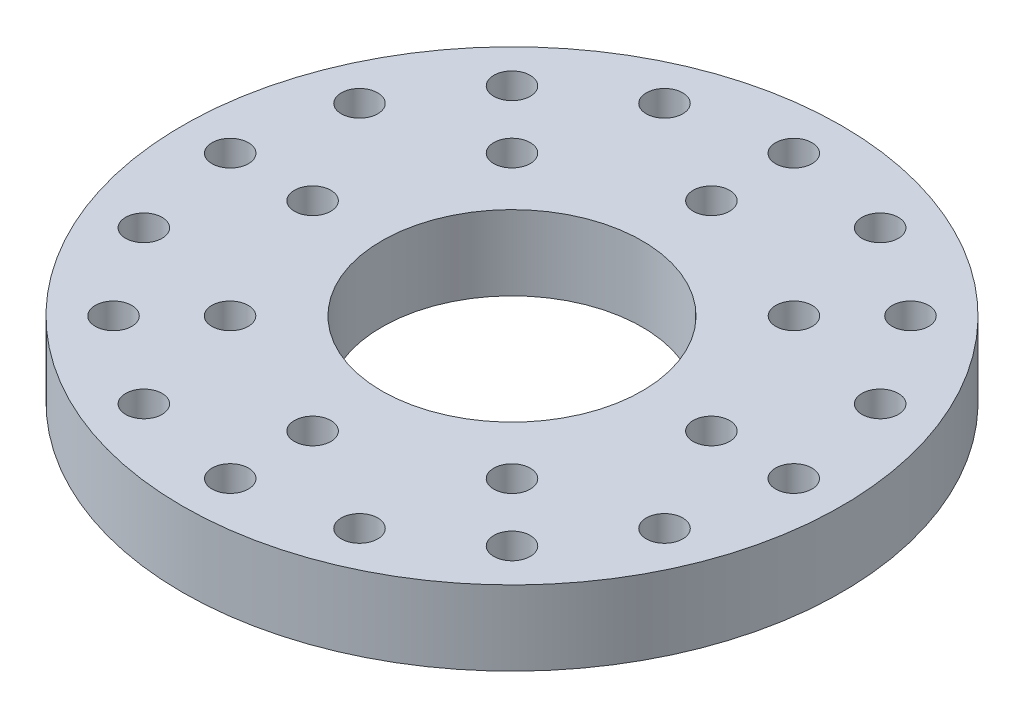
from build123d import *

# Parameters (mm, degrees)
SKETCH1_R          = 76.2
EXTRUDE1_DEPTH     = 17.272
SKETCH2_R          = 30.099
CUT_EXTRUDE1_DEPTH = 22.352
SKETCH3_R          = 4.2164
CUT_EXTRUDE3_DEPTH = 22.352
CIRPATTERN1_COUNT  = 8
SKETCH4_R          = 4.2164
CUT_EXTRUDE4_DEPTH = 22.352
CIRPATTERN2_COUNT  = 16


with BuildPart() as part:
    # Sketch1 → Extrude1 (new body)
    with BuildSketch(Plane(origin=(0, 0, 0), x_dir=(1, 0, 0), z_dir=(0, 1, 0))):
        Circle(SKETCH1_R)
    extrude(amount=EXTRUDE1_DEPTH)

    # Sketch2 → Cut-Extrude1 (cut)
    with BuildSketch(Plane(origin=(0, 0, 0), x_dir=(1, 0, 0), z_dir=(0, 1, 0))):
        Circle(SKETCH2_R)
    extrude(amount=CUT_EXTRUDE1_DEPTH, mode=Mode.SUBTRACT)

    # Sketch3 → Cut-Extrude3 (cut)
    with BuildSketch(Plane(origin=(0, 0, 0), x_dir=(1, 0, 0), z_dir=(0, 1, 0))):
        with Locations((0, 46.101)):
            Circle(SKETCH3_R)
    cut_extrude3 = extrude(amount=CUT_EXTRUDE3_DEPTH, mode=Mode.SUBTRACT)

    # CirPattern1: Cut-Extrude3 ×8 about axis
    cirpattern1_axis = Axis((0, 103.923475146, 0), (0, -1, 0))
    for i in range(1, CIRPATTERN1_COUNT):
        add(cut_extrude3.rotate(cirpattern1_axis, i * 360 / CIRPATTERN1_COUNT), mode=Mode.SUBTRACT)

    # Sketch4 → Cut-Extrude4 (cut)
    with BuildSketch(Plane(origin=(0, 0, 0), x_dir=(1, 0, 0), z_dir=(0, 1, 0))):
        with Locations((0, 65.151)):
            Circle(SKETCH4_R)
    cut_extrude4 = extrude(amount=CUT_EXTRUDE4_DEPTH, mode=Mode.SUBTRACT)

    # CirPattern2: Cut-Extrude4 ×16 about axis
    cirpattern2_axis = Axis((0, 103.923475146, 0), (0, -1, 0))
    for i in range(1, CIRPATTERN2_COUNT):
        add(cut_extrude4.rotate(cirpattern2_axis, i * 360 / CIRPATTERN2_COUNT), mode=Mode.SUBTRACT)


solid = part.part
